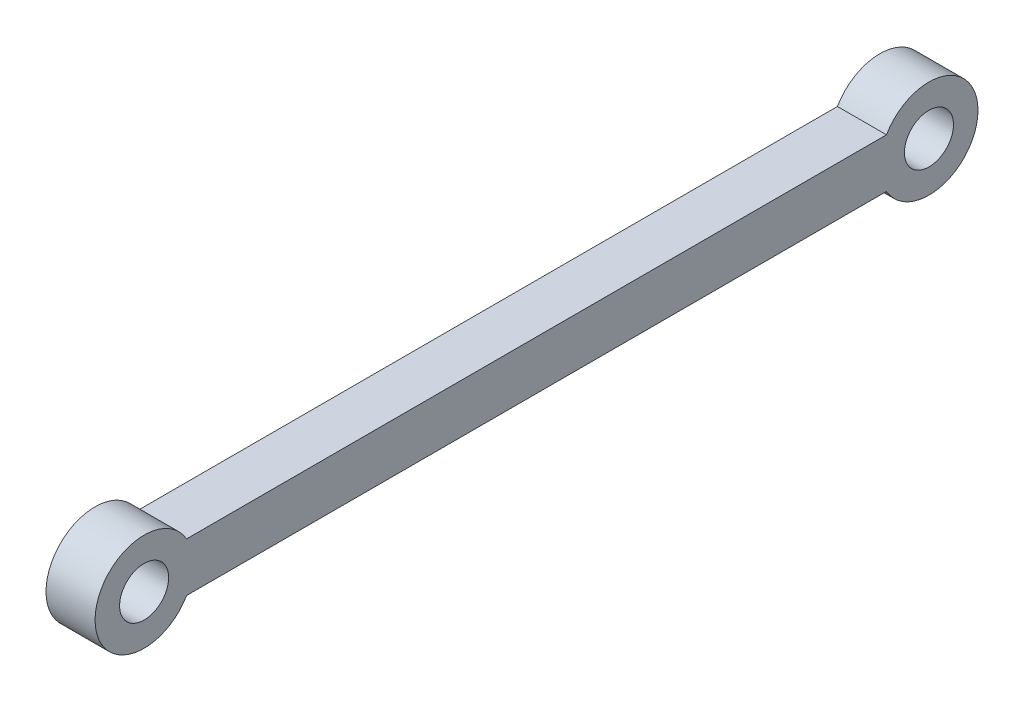
from build123d import *

# Parameters (mm, degrees)
SKETCH_1_R      = 1.25
EXTRUDE_1_DEPTH = 2.5


with BuildPart() as part:
    # 스케치1 → 보스-돌출1 (new body)
    with BuildSketch(Plane(origin=(0, 0, 0), x_dir=(0, 0, -1), z_dir=(1, 0, 0))):
        with BuildLine():
            Line((-17.834936491, 1.25), (17.834936491, 1.25))
            ThreePointArc((17.834936491, 1.25), (22.5, 0), (17.834936491, -1.25))
            Line((17.834936491, -1.25), (-17.834936491, -1.25))
            ThreePointArc((-17.834936491, -1.25), (-22.5, 0), (-17.834936491, 1.25))
        make_face()
        with Locations((-20, 0)):
            Circle(SKETCH_1_R, mode=Mode.SUBTRACT)
        with Locations((20, 0)):
            Circle(SKETCH_1_R, mode=Mode.SUBTRACT)
    extrude(amount=EXTRUDE_1_DEPTH)


solid = part.part
